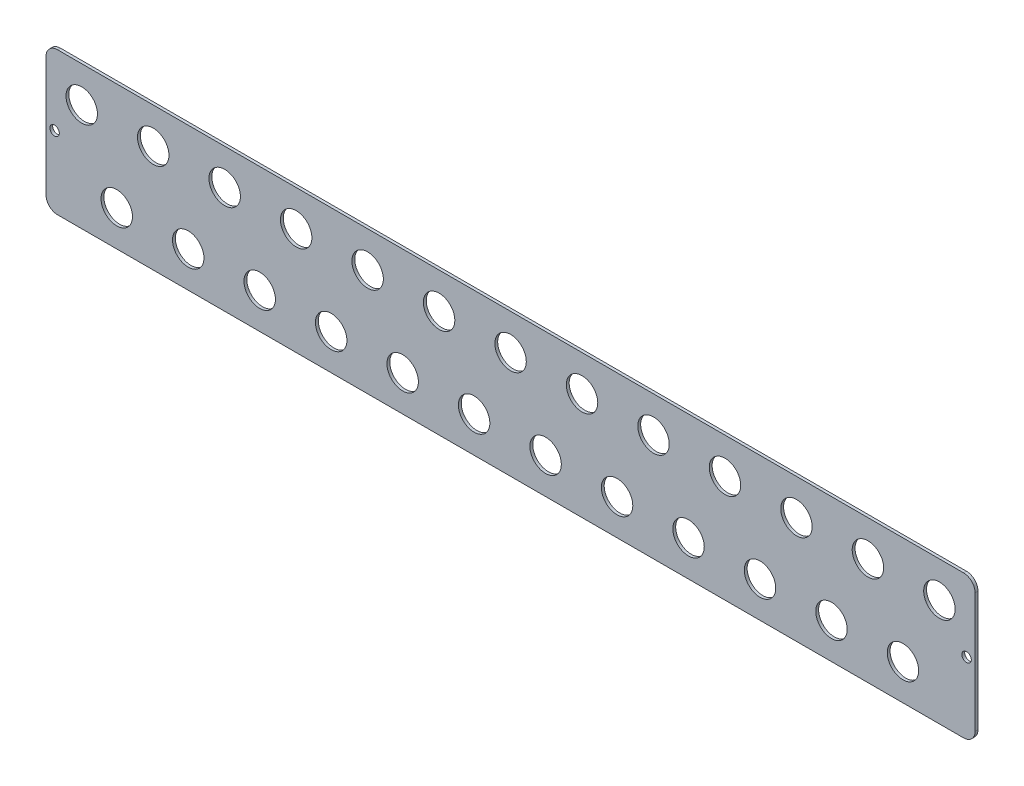
from build123d import *

# Parameters (mm, degrees)
BOSS_EXTRUDE1_DEPTH      = 2
SKETCH2_R                = 3
CUT_EXTRUDE2_DEPTH       = 10
LPATTERN1_COUNT          = 13
LPATTERN1_PITCH          = 50
LPATTERN2_COUNT          = 2
LPATTERN2_PITCH          = 50
LPATTERN2_COUNT_DIR2     = 2
LPATTERN2_PITCH_DIR2     = 25.5
M6_CLEARANCE_HOLE2_D     = 6.6
M6_CLEARANCE_HOLE2_DEPTH = 6
M6_CLEARANCE_HOLE2_TIP   = 1.982840043


with BuildPart() as part:
    # Sketch1 → Boss-Extrude1 (new body)
    with BuildSketch(Plane.XY):
        with BuildLine():
            Line((-316.901308233, -50), (316.901308233, -50))
            ThreePointArc((316.901308233, -50), (322.6279481, -47.6279481), (325, -41.901308233))
            Line((325, -41.901308233), (325, 41.901308233))
            ThreePointArc((325, 41.901308233), (322.6279481, 47.6279481), (316.901308233, 50))
            Line((316.901308233, 50), (-316.901308233, 50))
            ThreePointArc((-316.901308233, 50), (-322.6279481, 47.6279481), (-325, 41.901308233))
            Line((-325, 41.901308233), (-325, -41.901308233))
            ThreePointArc((-325, -41.901308233), (-322.6279481, -47.6279481), (-316.901308233, -50))
        make_face()
    extrude(amount=BOSS_EXTRUDE1_DEPTH)

    # Sketch2 → Cut-Extrude2 (cut)
    with BuildSketch(Plane.XY.offset(2)):
        with Locations((300, 25)):
            Circle(SKETCH2_R)
        with Locations((-319, 0)):
            Circle(SKETCH2_R)
        with Locations((319, 0)):
            Circle(SKETCH2_R)
    extrude(amount=-CUT_EXTRUDE2_DEPTH, mode=Mode.SUBTRACT)

    # Sketch5 → M20 Clearance Hole2 (revolve, cut)
    with BuildSketch(Plane(origin=(300, 25, 2), x_dir=(0, -1, 0), z_dir=(1, 0, 0))):
        Polygon((0, 0), (0, 12.609466809), (11, 6), (11, 0), align=None)
    m20_clearance_hole2 = revolve(axis=Axis((300, 25, 8.35), (0, 0, -1)), mode=Mode.SUBTRACT)

    # LPattern1: M20 Clearance Hole2 ×13
    with Locations(*[(-i * LPATTERN1_PITCH, 0, 0) for i in range(1, LPATTERN1_COUNT)]):
        add(m20_clearance_hole2, mode=Mode.SUBTRACT)

    # LPattern2: M20 Clearance Hole2 2 × 2, 2 skipped
    with Locations(*[(-j * LPATTERN2_PITCH_DIR2, -i * LPATTERN2_PITCH, 0) for i in range(LPATTERN2_COUNT) for j in range(LPATTERN2_COUNT_DIR2) if (i, j) not in ((0, 0), (0, 1), (1, 0))]):
        add(m20_clearance_hole2, mode=Mode.SUBTRACT)

    # LPattern3 copy 1 sketch → LPattern3 copy 1 (revolve, cut)
    with BuildSketch(Plane(origin=(224.5, -25, 2), x_dir=(0, -1, 0), z_dir=(1, 0, 0))):
        Polygon((0, 0), (0, 12.609466809), (11, 6), (11, 0), align=None)
    revolve(axis=Axis((224.5, -25, 8.35), (0, 0, -1)), mode=Mode.SUBTRACT)

    # LPattern3 copy 2 sketch → LPattern3 copy 2 (revolve, cut)
    with BuildSketch(Plane(origin=(174.5, -25, 2), x_dir=(0, -1, 0), z_dir=(1, 0, 0))):
        Polygon((0, 0), (0, 12.609466809), (11, 6), (11, 0), align=None)
    revolve(axis=Axis((174.5, -25, 8.35), (0, 0, -1)), mode=Mode.SUBTRACT)

    # LPattern3 copy 3 sketch → LPattern3 copy 3 (revolve, cut)
    with BuildSketch(Plane(origin=(124.5, -25, 2), x_dir=(0, -1, 0), z_dir=(1, 0, 0))):
        Polygon((0, 0), (0, 12.609466809), (11, 6), (11, 0), align=None)
    revolve(axis=Axis((124.5, -25, 8.35), (0, 0, -1)), mode=Mode.SUBTRACT)

    # LPattern3 copy 4 sketch → LPattern3 copy 4 (revolve, cut)
    with BuildSketch(Plane(origin=(74.5, -25, 2), x_dir=(0, -1, 0), z_dir=(1, 0, 0))):
        Polygon((0, 0), (0, 12.609466809), (11, 6), (11, 0), align=None)
    revolve(axis=Axis((74.5, -25, 8.35), (0, 0, -1)), mode=Mode.SUBTRACT)

    # LPattern3 copy 5 sketch → LPattern3 copy 5 (revolve, cut)
    with BuildSketch(Plane(origin=(24.5, -25, 2), x_dir=(0, -1, 0), z_dir=(1, 0, 0))):
        Polygon((0, 0), (0, 12.609466809), (11, 6), (11, 0), align=None)
    revolve(axis=Axis((24.5, -25, 8.35), (0, 0, -1)), mode=Mode.SUBTRACT)

    # LPattern3 copy 6 sketch → LPattern3 copy 6 (revolve, cut)
    with BuildSketch(Plane(origin=(-25.5, -25, 2), x_dir=(0, -1, 0), z_dir=(1, 0, 0))):
        Polygon((0, 0), (0, 12.609466809), (11, 6), (11, 0), align=None)
    revolve(axis=Axis((-25.5, -25, 8.35), (0, 0, -1)), mode=Mode.SUBTRACT)

    # LPattern3 copy 7 sketch → LPattern3 copy 7 (revolve, cut)
    with BuildSketch(Plane(origin=(-75.5, -25, 2), x_dir=(0, -1, 0), z_dir=(1, 0, 0))):
        Polygon((0, 0), (0, 12.609466809), (11, 6), (11, 0), align=None)
    revolve(axis=Axis((-75.5, -25, 8.35), (0, 0, -1)), mode=Mode.SUBTRACT)

    # LPattern3 copy 8 sketch → LPattern3 copy 8 (revolve, cut)
    with BuildSketch(Plane(origin=(-125.5, -25, 2), x_dir=(0, -1, 0), z_dir=(1, 0, 0))):
        Polygon((0, 0), (0, 12.609466809), (11, 6), (11, 0), align=None)
    revolve(axis=Axis((-125.5, -25, 8.35), (0, 0, -1)), mode=Mode.SUBTRACT)

    # LPattern3 copy 9 sketch → LPattern3 copy 9 (revolve, cut)
    with BuildSketch(Plane(origin=(-175.5, -25, 2), x_dir=(0, -1, 0), z_dir=(1, 0, 0))):
        Polygon((0, 0), (0, 12.609466809), (11, 6), (11, 0), align=None)
    revolve(axis=Axis((-175.5, -25, 8.35), (0, 0, -1)), mode=Mode.SUBTRACT)

    # LPattern3 copy 10 sketch → LPattern3 copy 10 (revolve, cut)
    with BuildSketch(Plane(origin=(-225.5, -25, 2), x_dir=(0, -1, 0), z_dir=(1, 0, 0))):
        Polygon((0, 0), (0, 12.609466809), (11, 6), (11, 0), align=None)
    revolve(axis=Axis((-225.5, -25, 8.35), (0, 0, -1)), mode=Mode.SUBTRACT)

    # LPattern3 copy 11 sketch → LPattern3 copy 11 (revolve, cut)
    with BuildSketch(Plane(origin=(-275.5, -25, 2), x_dir=(0, -1, 0), z_dir=(1, 0, 0))):
        Polygon((0, 0), (0, 12.609466809), (11, 6), (11, 0), align=None)
    revolve(axis=Axis((-275.5, -25, 8.35), (0, 0, -1)), mode=Mode.SUBTRACT)

    # LPattern3 copy 12 sketch → LPattern3 copy 12 (revolve, cut)
    with BuildSketch(Plane(origin=(250, 25, 2), x_dir=(0, -1, 0), z_dir=(1, 0, 0))):
        Polygon((0, 0), (0, 12.609466809), (11, 6), (11, 0), align=None)
    revolve(axis=Axis((250, 25, 8.35), (0, 0, -1)), mode=Mode.SUBTRACT)

    # LPattern3 copy 13 sketch → LPattern3 copy 13 (revolve, cut)
    with BuildSketch(Plane(origin=(200, 25, 2), x_dir=(0, -1, 0), z_dir=(1, 0, 0))):
        Polygon((0, 0), (0, 12.609466809), (11, 6), (11, 0), align=None)
    revolve(axis=Axis((200, 25, 8.35), (0, 0, -1)), mode=Mode.SUBTRACT)

    # LPattern3 copy 14 sketch → LPattern3 copy 14 (revolve, cut)
    with BuildSketch(Plane(origin=(150, 25, 2), x_dir=(0, -1, 0), z_dir=(1, 0, 0))):
        Polygon((0, 0), (0, 12.609466809), (11, 6), (11, 0), align=None)
    revolve(axis=Axis((150, 25, 8.35), (0, 0, -1)), mode=Mode.SUBTRACT)

    # LPattern3 copy 15 sketch → LPattern3 copy 15 (revolve, cut)
    with BuildSketch(Plane(origin=(100, 25, 2), x_dir=(0, -1, 0), z_dir=(1, 0, 0))):
        Polygon((0, 0), (0, 12.609466809), (11, 6), (11, 0), align=None)
    revolve(axis=Axis((100, 25, 8.35), (0, 0, -1)), mode=Mode.SUBTRACT)

    # LPattern3 copy 16 sketch → LPattern3 copy 16 (revolve, cut)
    with BuildSketch(Plane(origin=(50, 25, 2), x_dir=(0, -1, 0), z_dir=(1, 0, 0))):
        Polygon((0, 0), (0, 12.609466809), (11, 6), (11, 0), align=None)
    revolve(axis=Axis((50, 25, 8.35), (0, 0, -1)), mode=Mode.SUBTRACT)

    # LPattern3 copy 17 sketch → LPattern3 copy 17 (revolve, cut)
    with BuildSketch(Plane(origin=(0, 25, 2), x_dir=(0, -1, 0), z_dir=(1, 0, 0))):
        Polygon((0, 0), (0, 12.609466809), (11, 6), (11, 0), align=None)
    revolve(axis=Axis((0, 25, 8.35), (0, 0, -1)), mode=Mode.SUBTRACT)

    # LPattern3 copy 18 sketch → LPattern3 copy 18 (revolve, cut)
    with BuildSketch(Plane(origin=(-50, 25, 2), x_dir=(0, -1, 0), z_dir=(1, 0, 0))):
        Polygon((0, 0), (0, 12.609466809), (11, 6), (11, 0), align=None)
    revolve(axis=Axis((-50, 25, 8.35), (0, 0, -1)), mode=Mode.SUBTRACT)

    # LPattern3 copy 19 sketch → LPattern3 copy 19 (revolve, cut)
    with BuildSketch(Plane(origin=(-100, 25, 2), x_dir=(0, -1, 0), z_dir=(1, 0, 0))):
        Polygon((0, 0), (0, 12.609466809), (11, 6), (11, 0), align=None)
    revolve(axis=Axis((-100, 25, 8.35), (0, 0, -1)), mode=Mode.SUBTRACT)

    # LPattern3 copy 20 sketch → LPattern3 copy 20 (revolve, cut)
    with BuildSketch(Plane(origin=(-150, 25, 2), x_dir=(0, -1, 0), z_dir=(1, 0, 0))):
        Polygon((0, 0), (0, 12.609466809), (11, 6), (11, 0), align=None)
    revolve(axis=Axis((-150, 25, 8.35), (0, 0, -1)), mode=Mode.SUBTRACT)

    # LPattern3 copy 21 sketch → LPattern3 copy 21 (revolve, cut)
    with BuildSketch(Plane(origin=(-200, 25, 2), x_dir=(0, -1, 0), z_dir=(1, 0, 0))):
        Polygon((0, 0), (0, 12.609466809), (11, 6), (11, 0), align=None)
    revolve(axis=Axis((-200, 25, 8.35), (0, 0, -1)), mode=Mode.SUBTRACT)

    # LPattern3 copy 22 sketch → LPattern3 copy 22 (revolve, cut)
    with BuildSketch(Plane(origin=(-250, 25, 2), x_dir=(0, -1, 0), z_dir=(1, 0, 0))):
        Polygon((0, 0), (0, 12.609466809), (11, 6), (11, 0), align=None)
    revolve(axis=Axis((-250, 25, 8.35), (0, 0, -1)), mode=Mode.SUBTRACT)

    # M6 Clearance Hole2
    with Locations(Plane(origin=(0, 0, 0), x_dir=(-1, 0, 0), z_dir=(0, 0, -1))):
        with Locations((319, 0), (-319, 0)):
            Hole(M6_CLEARANCE_HOLE2_D / 2, depth=M6_CLEARANCE_HOLE2_DEPTH)
            with Locations((0, 0, -(M6_CLEARANCE_HOLE2_DEPTH + M6_CLEARANCE_HOLE2_TIP / 2))):  # 118° drill point
                Cone(0, M6_CLEARANCE_HOLE2_D / 2, M6_CLEARANCE_HOLE2_TIP, mode=Mode.SUBTRACT)


solid = part.part
